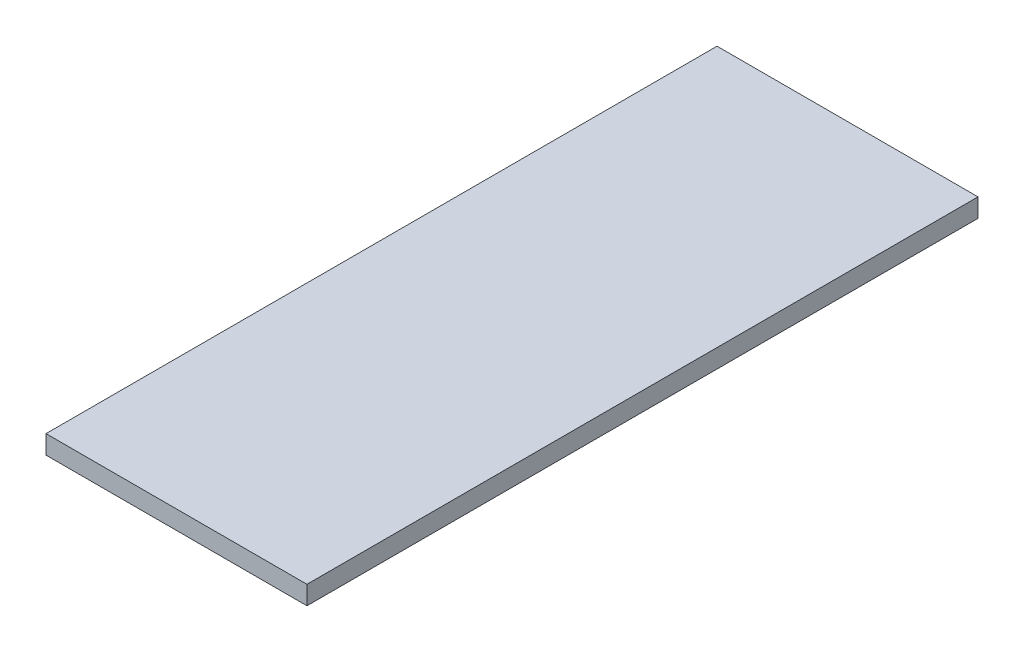
from build123d import *

# Parameters (mm, degrees)
SKETCH1_W           = 70
SKETCH1_H           = 180
BOSS_EXTRUDE1_DEPTH = 5
SKETCH2_R           = 4
CUT_EXTRUDE1_DEPTH  = 2


with BuildPart() as part:
    # Sketch1 → Boss-Extrude1 (new body)
    with BuildSketch(Plane(origin=(0, 0, 0), x_dir=(1, 0, 0), z_dir=(0, 1, 0))):
        Rectangle(SKETCH1_W, SKETCH1_H)
    extrude(amount=BOSS_EXTRUDE1_DEPTH)

    # Sketch2 → Cut-Extrude1 (cut)
    with BuildSketch(Plane.XZ):
        with Locations(Location((-30, 84.56907943, 0), (0, 0, 270))):
            Circle(SKETCH2_R)
        with Locations(Location((29.895547188, 84.56907943, 0), (0, 0, 270))):
            Circle(SKETCH2_R)
        with Locations(Location((-30, -85, 0), (0, 0, 270))):
            Circle(SKETCH2_R)
        with Locations(Location((29.895547188, -85, 0), (0, 0, 270))):
            Circle(SKETCH2_R)
    extrude(amount=-CUT_EXTRUDE1_DEPTH, mode=Mode.SUBTRACT)


solid = part.part
